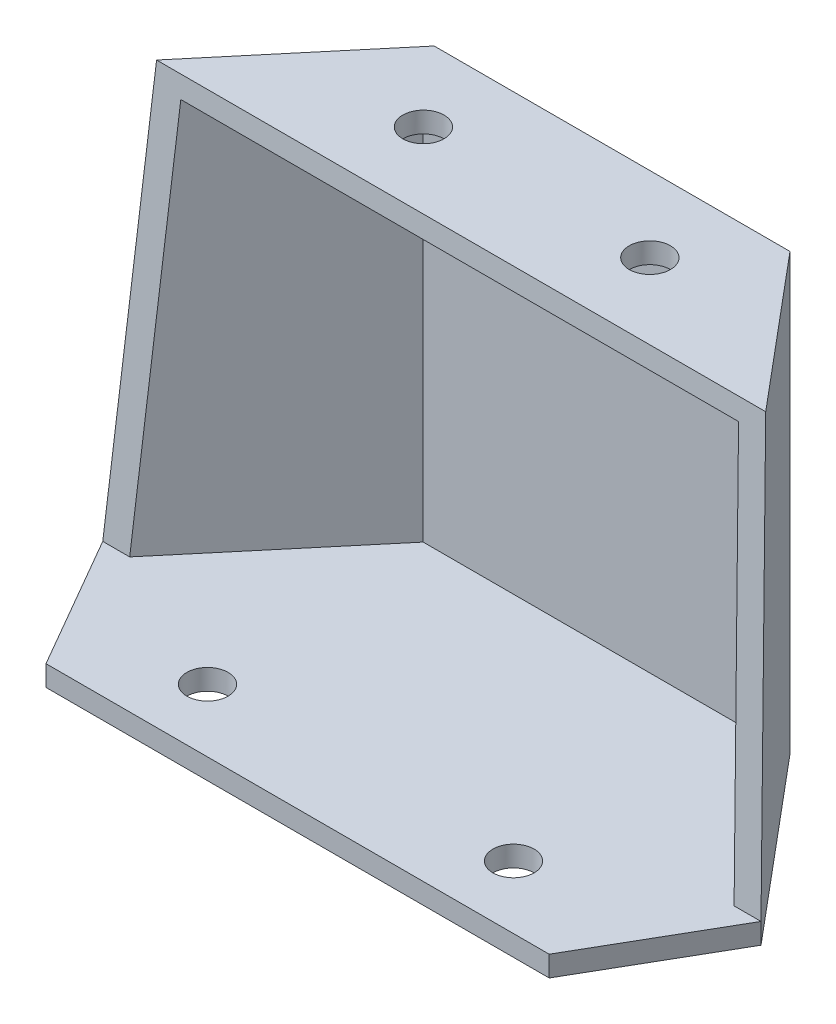
from build123d import *

# Parameters (mm, degrees)
EXTRUDE_1_DEPTH          = 211
SHELL_1_T                = 10
CUT_EXTRUDE_2_DEPTH      = 306.363666708
CUT_EXTRUDE_2_DEPTH_BACK = 306.363666708
CUT_EXTRUDE_3_REACH      = 307.364
SKETCH_3_R               = 10
CUT_EXTRUDE_4_REACH      = 300.541
SKETCH_4_R               = 10


with BuildPart() as part:
    # 草图1 → 凸台-拉伸1 (new body)
    with BuildSketch(Plane(origin=(0, 0, 0), x_dir=(1, 0, 0), z_dir=(0, 1, 0))):
        Polygon((122, 0), (-122, 0), (-159.592352403, 65.111864338), (-86.265, 152.5), (86.265, 152.5), (159.592352403, 65.111864338), align=None)
    extrude(amount=EXTRUDE_1_DEPTH)

    # 抽壳1 (no face opened: a closed hollow body)
    add(offset(amount=-SHELL_1_T, mode=Mode.PRIVATE), mode=Mode.SUBTRACT)

    # 草图2 → 切除-拉伸2 (cut, two sides: drawn at the far end of the back side and taken through both)
    with BuildSketch(Plane(origin=(0, 0, 0), x_dir=(0, 0, -1), z_dir=(1, 0, 0)).offset(-CUT_EXTRUDE_2_DEPTH_BACK)):
        Polygon((79.3, 211), (65.111864338, 10), (0, 10), (0, 211), align=None)
    extrude(amount=CUT_EXTRUDE_2_DEPTH + CUT_EXTRUDE_2_DEPTH_BACK, mode=Mode.SUBTRACT)

    # 草图3 → 切除-拉伸3 (cut, up to next)
    with BuildSketch(Plane(origin=(0, 211, 0), x_dir=(1, 0, 0), z_dir=(0, 1, 0)), mode=Mode.PRIVATE) as cut_extrude_3_sk1:
        with Locations(Location((-54.9, 115.9, 0), (0, 0, 270))):
            Circle(SKETCH_3_R)
    cut_extrude_3_tool1 = extrude(cut_extrude_3_sk1.sketch, amount=-CUT_EXTRUDE_3_REACH, mode=Mode.PRIVATE) & part.part
    # 草图3 → 切除-拉伸3 (cut, up to next)
    with BuildSketch(Plane(origin=(0, 211, 0), x_dir=(1, 0, 0), z_dir=(0, 1, 0)), mode=Mode.PRIVATE) as cut_extrude_3_sk2:
        with Locations(Location((54.9, 115.9, 0), (0, 0, 270))):
            Circle(SKETCH_3_R)
    cut_extrude_3_tool2 = extrude(cut_extrude_3_sk2.sketch, amount=-CUT_EXTRUDE_3_REACH, mode=Mode.PRIVATE) & part.part
    add(cut_extrude_3_tool1.solids().sort_by_distance((-54.9, 211, -115.9))[0], mode=Mode.SUBTRACT)
    add(cut_extrude_3_tool2.solids().sort_by_distance((54.9, 211, -115.9))[0], mode=Mode.SUBTRACT)

    # 草图4 → 切除-拉伸4 (cut, up to next)
    with BuildSketch(Plane(origin=(0, 10, 0), x_dir=(1, 0, 0), z_dir=(0, 1, 0)), mode=Mode.PRIVATE) as cut_extrude_4_sk1:
        with Locations(Location((-74.2, 30.5, 0), (0, 0, 270))):
            Circle(SKETCH_4_R)
    cut_extrude_4_tool1 = extrude(cut_extrude_4_sk1.sketch, amount=-CUT_EXTRUDE_4_REACH, mode=Mode.PRIVATE) & part.part
    # 草图4 → 切除-拉伸4 (cut, up to next)
    with BuildSketch(Plane(origin=(0, 10, 0), x_dir=(1, 0, 0), z_dir=(0, 1, 0)), mode=Mode.PRIVATE) as cut_extrude_4_sk2:
        with Locations(Location((74.2, 30.5, 0), (0, 0, 270))):
            Circle(SKETCH_4_R)
    cut_extrude_4_tool2 = extrude(cut_extrude_4_sk2.sketch, amount=-CUT_EXTRUDE_4_REACH, mode=Mode.PRIVATE) & part.part
    add(cut_extrude_4_tool1.solids().sort_by_distance((-74.2, 10, -30.5))[0], mode=Mode.SUBTRACT)
    add(cut_extrude_4_tool2.solids().sort_by_distance((74.2, 10, -30.5))[0], mode=Mode.SUBTRACT)


solid = part.part
